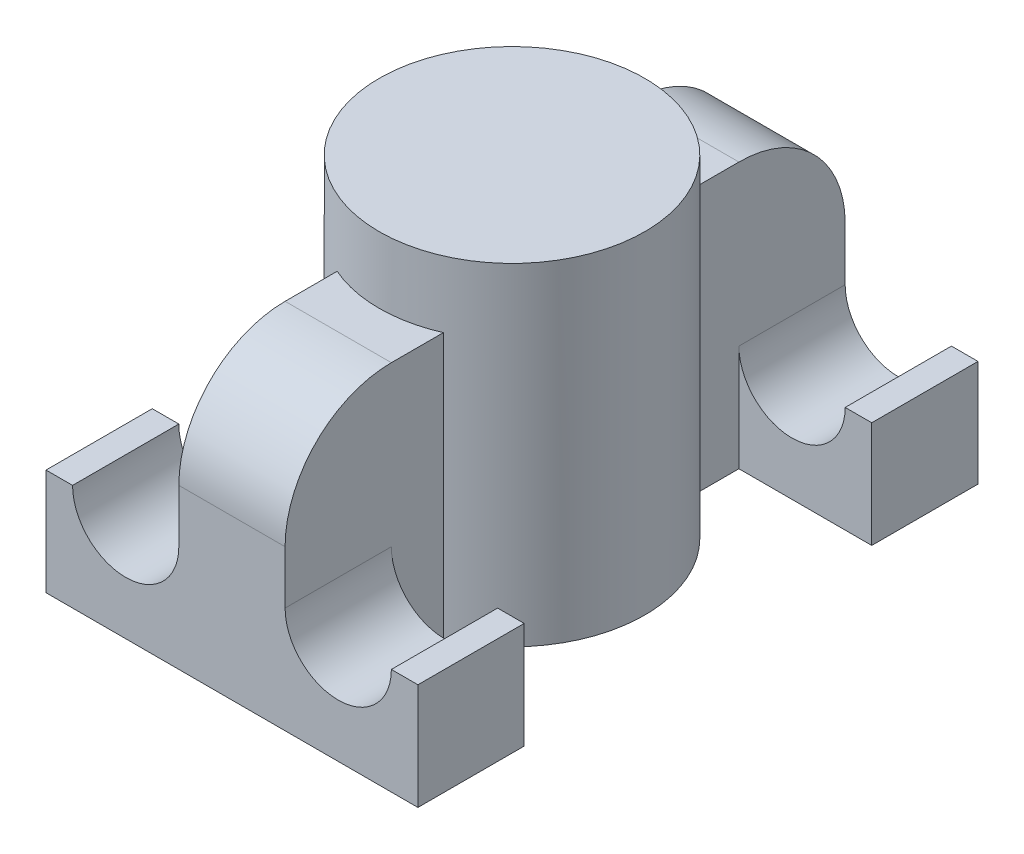
from build123d import *

# Parameters (mm, degrees)
SKETCH2_W                = 8
SKETCH2_H                = 42.16515139
BOSS_EXTRUDE3_DEPTH      = 20
BOSS_EXTRUDE4_DEPTH      = 5
BOSS_EXTRUDE4_DEPTH_BACK = 20
SKETCH4_R                = 10
HOLE1_D                  = 10
HOLE1_DEPTH              = 15
HOLE1_TIP                = 5
BOSS_EXTRUDE5_DEPTH      = 8
MIRROR3_COPY_1_DEPTH     = 8
FILLET1_R                = 8


with BuildPart() as part:
    # Sketch2 → Boss-Extrude3 (new body)
    with BuildSketch(Plane(origin=(0, 0, 0), x_dir=(1, 0, 0), z_dir=(0, 1, 0))):
        Rectangle(SKETCH2_W, SKETCH2_H)
    extrude(amount=BOSS_EXTRUDE3_DEPTH)

    # Sketch4 → Boss-Extrude4 (add, two sides: drawn at the far end of the back side and taken through both)
    with BuildSketch(Plane(origin=(0, 20, 0), x_dir=(-1, 0, 0), z_dir=(0, 1, 0)).offset(-BOSS_EXTRUDE4_DEPTH_BACK)):
        with Locations(Location((0, 0, 0), (0, 0, 90))):
            Circle(SKETCH4_R)
    extrude(amount=BOSS_EXTRUDE4_DEPTH + BOSS_EXTRUDE4_DEPTH_BACK)

    # Hole1
    with Locations(Plane.XZ):
        with Locations((0, 0)):
            Hole(HOLE1_D / 2, depth=HOLE1_DEPTH)
            with Locations((0, 0, -(HOLE1_DEPTH + HOLE1_TIP / 2))):  # 90° drill point
                Cone(0, HOLE1_D / 2, HOLE1_TIP, mode=Mode.SUBTRACT)

    # Sketch10 → Boss-Extrude5 (add)
    with BuildSketch(Plane.XY.offset(21.082575695)):
        with BuildLine():
            Line((-4, 0), (-14, 0))
            Line((-14, 0), (-14, 8))
            Line((-14, 8), (-12, 8))
            ThreePointArc((-12, 8), (-8, 4), (-4, 8))
            Line((-4, 8), (-4, 0))
        make_face()
    boss_extrude5 = extrude(amount=-BOSS_EXTRUDE5_DEPTH)

    # Mirror2: Boss-Extrude5 across plane
    add(boss_extrude5.mirror(Plane(origin=(0, 0, 0), x_dir=(0, 0, 1), z_dir=(1, 0, 0))))

    # Mirror3: Boss-Extrude5 across plane
    add(boss_extrude5.mirror(Plane.XY))

    # Mirror3 copy 1 sketch → Mirror3 copy 1 (add)
    with BuildSketch(Plane(origin=(0, 0, -21.082575695), x_dir=(-1, 0, 0), z_dir=(0, 0, -1))):
        with BuildLine():
            Line((-4, 0), (-14, 0))
            Line((-14, 0), (-14, 8))
            Line((-14, 8), (-12, 8))
            ThreePointArc((-12, 8), (-8, 4), (-4, 8))
            Line((-4, 8), (-4, 0))
        make_face()
    extrude(amount=-MIRROR3_COPY_1_DEPTH)

    # Fillet1
    fillet1_edges = [part.edges().sort_by_distance(p)[0] for p in [
        (0, 20, -21.082575695),
        (0, 20, 21.082575695),
    ]]
    fillet(fillet1_edges, radius=FILLET1_R)


solid = part.part
